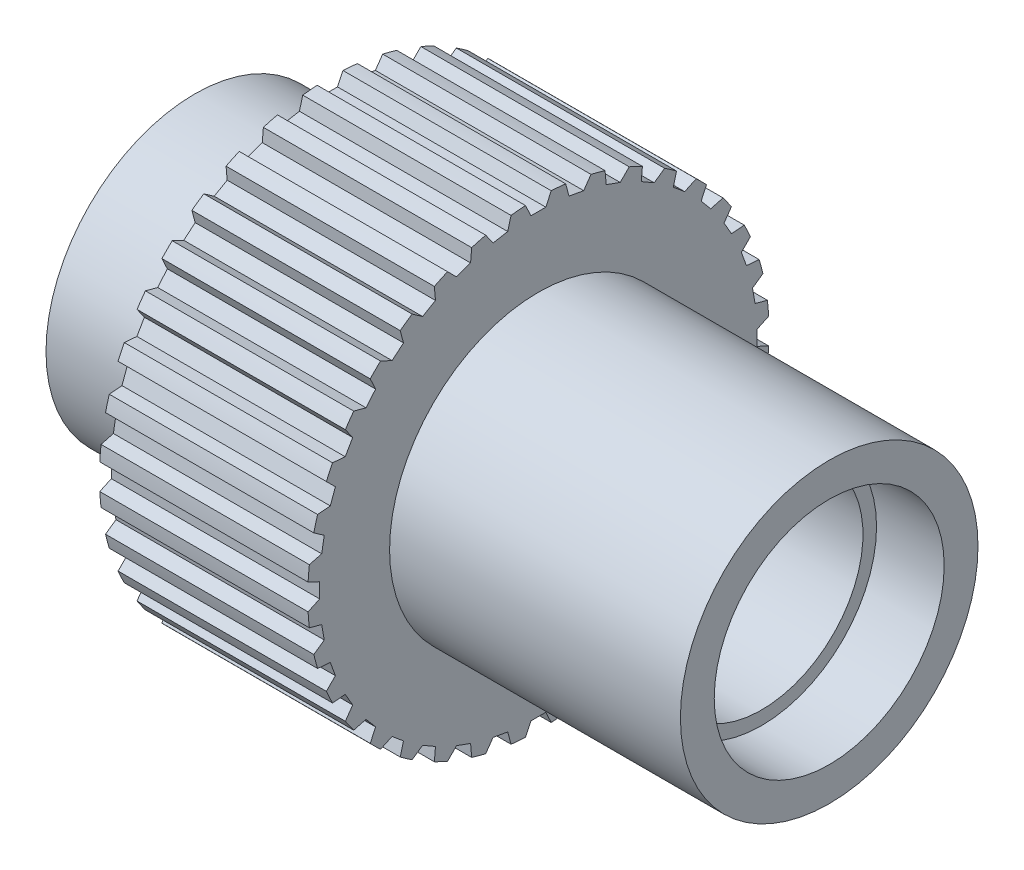
from build123d import *

# Parameters (mm, degrees)
EXTRUSION1_DEPTH             = 45.079643828
R_P_TITION_CIRCULAIRE1_COUNT = 36


with BuildPart() as part:
    # Esquisse1 → Révolution1 (revolve)
    with BuildSketch(Plane.XY, mode=Mode.PRIVATE) as r_volution1_sk:
        Polygon((21.5, 8.5), (21.5, 11), (0, 11), (0, 17.05), (-15.4, 17.05), (-15.4, 11), (-25.4, 11), (-25.4, 8.5), (-3.228913747, 8.5), (-3.228913747, 7.497868496), (16.5, 7.497868496), (16.5, 8.5), align=None)
    revolve(r_volution1_sk.sketch.rotate(Axis((-31.537627468, 0, 0), (1, 0, 0)), 90), axis=Axis((-31.537627468, 0, 0), (1, 0, 0)))

    # Esquisse2 → Extrusion1 (cut, through all)
    with BuildSketch(Plane.ZY.offset(15.4)):
        Polygon((-1, 17.131935336), (-0.551103456, 16.169273591), (0.551103456, 16.169273591), (1, 17.131935336), align=None)
    extrusion1 = extrude(amount=-EXTRUSION1_DEPTH, mode=Mode.SUBTRACT)

    # Répétition circulaire1: Extrusion1 ×36 about axis
    r_p_tition_circulaire1_axis = Axis((0, 0, 0), (1, 0, 0))
    for i in range(1, R_P_TITION_CIRCULAIRE1_COUNT):
        add(extrusion1.rotate(r_p_tition_circulaire1_axis, i * 360 / R_P_TITION_CIRCULAIRE1_COUNT), mode=Mode.SUBTRACT)


solid = part.part
